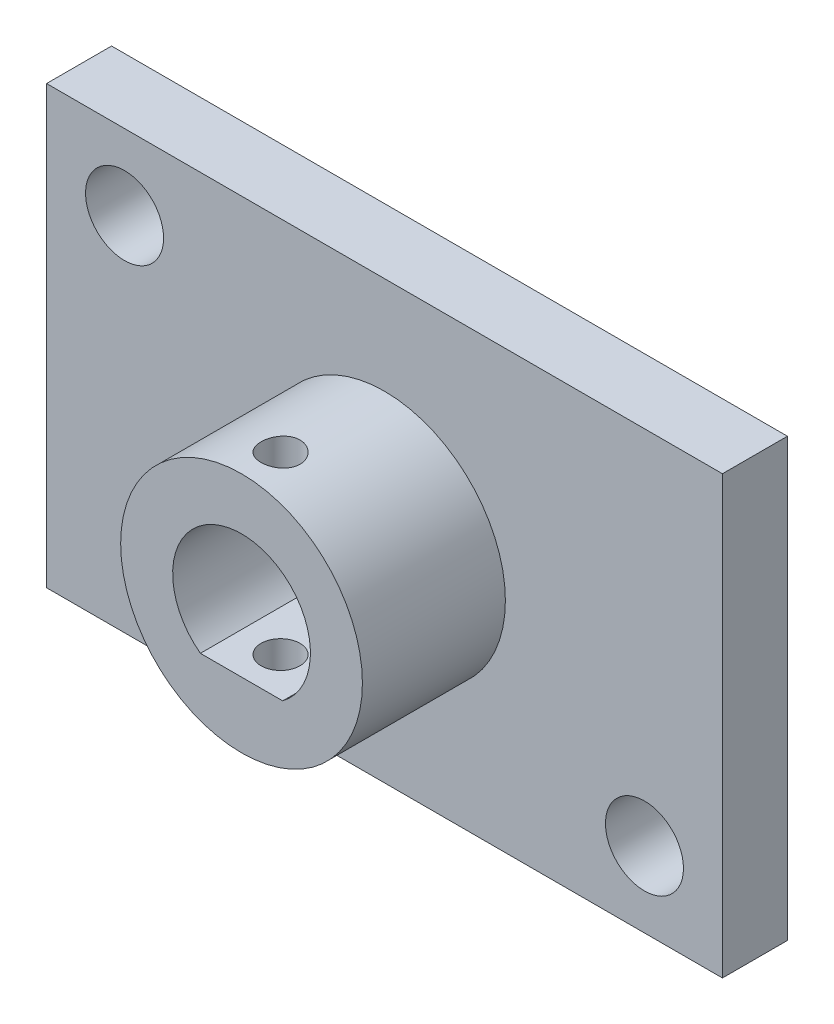
from build123d import *

# Parameters (mm, degrees)
SKETCH_1_W               = 52
SKETCH_1_H               = 33.6
EXTRUDE_1_DEPTH          = 5
SKETCH_3_R               = 3
CUT_EXTRUDE_2_DEPTH      = 5
SKETCH_4_R               = 9.3
EXTRUDE_2_DEPTH          = 11
CUT_EXTRUDE_3_DEPTH      = 11
CUT_EXTRUDE_3_DEPTH_BACK = 11
SKETCH_5_R               = 1.5


with BuildPart() as part:
    # 草图1 → 凸台-拉伸1 (new body)
    with BuildSketch(Plane.XY):
        Rectangle(SKETCH_1_W, SKETCH_1_H)
    extrude(amount=EXTRUDE_1_DEPTH)

    # 草图3 → 切除-拉伸2 (cut)
    with BuildSketch(Plane.XY.offset(5)):
        with Locations((-20, 11)):
            Circle(SKETCH_3_R)
        with Locations((20, -11)):
            Circle(SKETCH_3_R)
    extrude(amount=-CUT_EXTRUDE_2_DEPTH, mode=Mode.SUBTRACT)

    # 草图4 → 凸台-拉伸2 (add)
    with BuildSketch(Plane.XY.offset(5)):
        with Locations(Location((0, 0, 0), (0, 0, 180))):
            Circle(SKETCH_4_R)
        with BuildLine():
            Line((3.166622807, -4.25), (-3.166622807, -4.25))
            ThreePointArc((-3.166622807, -4.25), (0, 5.3), (3.166622807, -4.25))
        make_face(mode=Mode.SUBTRACT)
    extrude(amount=EXTRUDE_2_DEPTH)

    # 草图5 → 切除-拉伸3 (cut, two sides: drawn at the far end of the back side and taken through both)
    with BuildSketch(Plane(origin=(0, 0, 0), x_dir=(1, 0, 0), z_dir=(0, 1, 0)).offset(-CUT_EXTRUDE_3_DEPTH_BACK)):
        with Locations(Location((0, -13, 0), (0, 0, 90))):
            Circle(SKETCH_5_R)
    extrude(amount=CUT_EXTRUDE_3_DEPTH + CUT_EXTRUDE_3_DEPTH_BACK, mode=Mode.SUBTRACT)


solid = part.part
